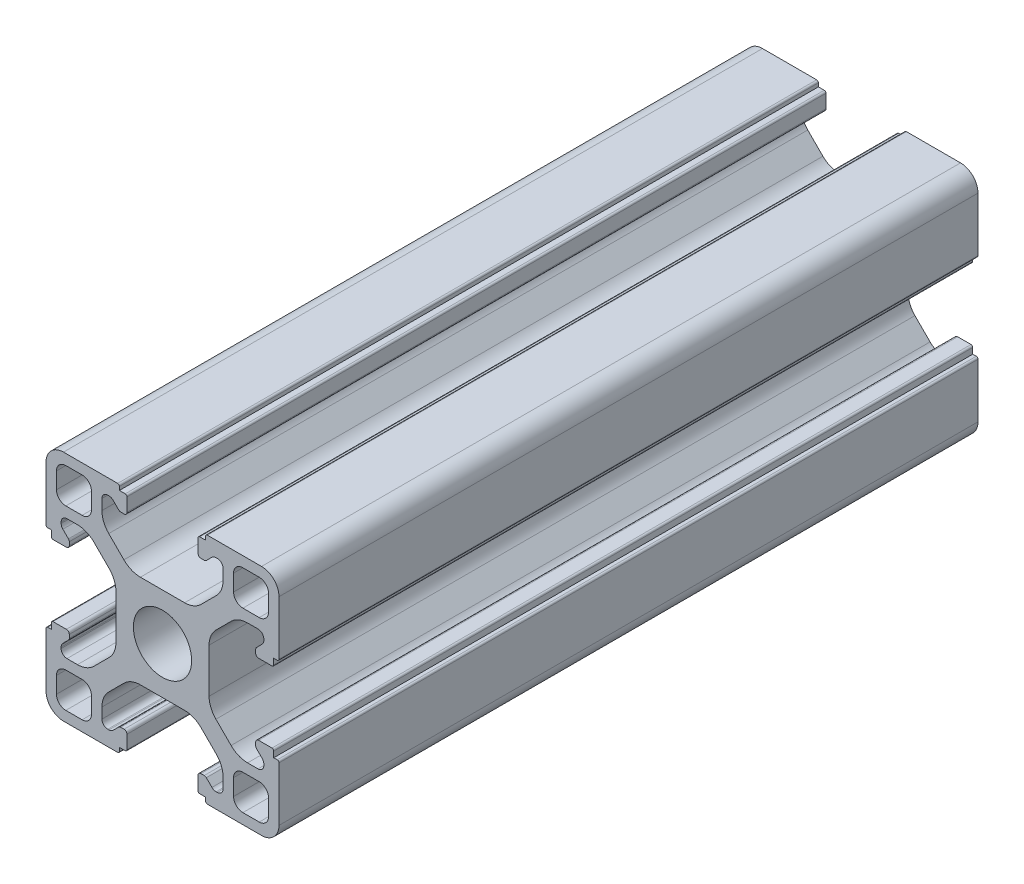
from build123d import *

# Parameters (mm, degrees)
EXTRUDE_1_DEPTH = 60


with BuildPart() as part:
    # Эскиз1 → Бобышка-Вытянуть1 (new body)
    with BuildSketch(Plane.XY):
        with BuildLine():
            Line((-0.000296307, 4.55357973), (1.898484362, 4.55357973))
            ThreePointArc((1.898484362, 4.55357973), (2.663851227, 4.705820665), (3.312697924, 5.139366167))
            Line((3.312697924, 5.139366167), (4.613917255, 6.440585498))
            ThreePointArc((4.613917255, 6.440585498), (5.047462758, 7.089432196), (5.199703693, 7.854799061))
            Line((5.199703693, 7.854799061), (5.199703693, 8.75357973))
            ThreePointArc((5.199703693, 8.75357973), (5.053257083, 9.10713312), (4.699703693, 9.25357973))
            Line((4.699703693, 9.25357973), (4.596810474, 9.25357973))
            ThreePointArc((4.596810474, 9.25357973), (4.405468758, 9.215519496), (4.243257083, 9.10713312))
            Line((4.243257083, 9.10713312), (3.762926997, 8.626803034))
            ThreePointArc((3.762926997, 8.626803034), (3.68182116, 8.572609847), (3.586150302, 8.55357973))
            Line((3.586150302, 8.55357973), (3.299703693, 8.55357973))
            ThreePointArc((3.299703693, 8.55357973), (3.122926997, 8.626803034), (3.049703693, 8.80357973))
            Line((3.049703693, 8.80357973), (3.049703693, 9.95265055))
            ThreePointArc((3.049703693, 9.95265055), (3.093637676, 10.058716567), (3.199703693, 10.10265055))
            Line((3.199703693, 10.10265055), (3.699703693, 10.10265055))
            Line((3.699703693, 10.10265055), (3.699703693, 10.40357973))
            ThreePointArc((3.699703693, 10.40357973), (3.743637676, 10.509645747), (3.849703693, 10.55357973))
            Line((3.849703693, 10.55357973), (8.499703693, 10.55357973))
            ThreePointArc((8.499703693, 10.55357973), (9.560363865, 10.114239901), (9.999703693, 9.05357973))
            Line((9.999703693, 9.05357973), (9.999703693, 4.40357973))
            ThreePointArc((9.999703693, 4.40357973), (9.95576971, 4.297513712), (9.849703693, 4.25357973))
            Line((9.849703693, 4.25357973), (9.548774513, 4.25357973))
            Line((9.548774513, 4.25357973), (9.548774513, 3.75357973))
            ThreePointArc((9.548774513, 3.75357973), (9.50484053, 3.647513712), (9.398774513, 3.60357973))
            Line((9.398774513, 3.60357973), (8.249703693, 3.60357973))
            ThreePointArc((8.249703693, 3.60357973), (8.072926997, 3.676803034), (7.999703693, 3.85357973))
            Line((7.999703693, 3.85357973), (7.999703693, 4.140026339))
            ThreePointArc((7.999703693, 4.140026339), (8.01873381, 4.235697197), (8.072926997, 4.316803034))
            Line((8.072926997, 4.316803034), (8.553257083, 4.79713312))
            ThreePointArc((8.553257083, 4.79713312), (8.661643459, 4.959344795), (8.699703693, 5.150686511))
            Line((8.699703693, 5.150686511), (8.699703693, 5.25357973))
            ThreePointArc((8.699703693, 5.25357973), (8.553257083, 5.60713312), (8.199703693, 5.75357973))
            Line((8.199703693, 5.75357973), (7.300923024, 5.75357973))
            ThreePointArc((7.300923024, 5.75357973), (6.535556159, 5.601338795), (5.886709461, 5.167793292))
            Line((5.886709461, 5.167793292), (4.58549013, 3.866573961))
            ThreePointArc((4.58549013, 3.866573961), (4.151944628, 3.217727263), (3.999703693, 2.452360399))
            Line((3.999703693, 2.452360399), (3.999703693, 0.55357973))
            Line((3.999703693, 0.55357973), (3.999703693, -1.345200939))
            ThreePointArc((3.999703693, -1.345200939), (4.151944628, -2.110567804), (4.58549013, -2.759414502))
            Line((4.58549013, -2.759414502), (5.886709461, -4.060633833))
            ThreePointArc((5.886709461, -4.060633833), (6.535556159, -4.494179335), (7.300923024, -4.64642027))
            Line((7.300923024, -4.64642027), (8.199703693, -4.64642027))
            ThreePointArc((8.199703693, -4.64642027), (8.553257083, -4.499973661), (8.699703693, -4.14642027))
            Line((8.699703693, -4.14642027), (8.699703693, -4.043527052))
            ThreePointArc((8.699703693, -4.043527052), (8.661643459, -3.852185335), (8.553257083, -3.689973661))
            Line((8.553257083, -3.689973661), (8.072926997, -3.209643575))
            ThreePointArc((8.072926997, -3.209643575), (8.01873381, -3.128537738), (7.999703693, -3.03286688))
            Line((7.999703693, -3.03286688), (7.999703693, -2.74642027))
            ThreePointArc((7.999703693, -2.74642027), (8.072926997, -2.569643575), (8.249703693, -2.49642027))
            Line((8.249703693, -2.49642027), (9.398774513, -2.49642027))
            ThreePointArc((9.398774513, -2.49642027), (9.50484053, -2.540354253), (9.548774513, -2.64642027))
            Line((9.548774513, -2.64642027), (9.548774513, -3.14642027))
            Line((9.548774513, -3.14642027), (9.849703693, -3.14642027))
            ThreePointArc((9.849703693, -3.14642027), (9.95576971, -3.190354253), (9.999703693, -3.29642027))
            Line((9.999703693, -3.29642027), (9.999703693, -7.94642027))
            ThreePointArc((9.999703693, -7.94642027), (9.560363865, -9.007080442), (8.499703693, -9.44642027))
            Line((8.499703693, -9.44642027), (3.849703693, -9.44642027))
            ThreePointArc((3.849703693, -9.44642027), (3.743637676, -9.402486288), (3.699703693, -9.29642027))
            Line((3.699703693, -9.29642027), (3.699703693, -8.995491091))
            Line((3.699703693, -8.995491091), (3.199703693, -8.995491091))
            ThreePointArc((3.199703693, -8.995491091), (3.093637676, -8.951557108), (3.049703693, -8.845491091))
            Line((3.049703693, -8.845491091), (3.049703693, -7.69642027))
            ThreePointArc((3.049703693, -7.69642027), (3.122926997, -7.519643575), (3.299703693, -7.44642027))
            Line((3.299703693, -7.44642027), (3.586150302, -7.44642027))
            ThreePointArc((3.586150302, -7.44642027), (3.68182116, -7.465450387), (3.762926997, -7.519643575))
            Line((3.762926997, -7.519643575), (4.243257083, -7.999973661))
            ThreePointArc((4.243257083, -7.999973661), (4.405468758, -8.108360037), (4.596810474, -8.14642027))
            Line((4.596810474, -8.14642027), (4.699703693, -8.14642027))
            ThreePointArc((4.699703693, -8.14642027), (5.053257083, -7.999973661), (5.199703693, -7.64642027))
            Line((5.199703693, -7.64642027), (5.199703693, -6.747639601))
            ThreePointArc((5.199703693, -6.747639601), (5.047462758, -5.982272737), (4.613917255, -5.333426039))
            Line((4.613917255, -5.333426039), (3.312697924, -4.032206708))
            ThreePointArc((3.312697924, -4.032206708), (2.663851227, -3.598661205), (1.898484362, -3.44642027))
            Line((1.898484362, -3.44642027), (-0.000296307, -3.44642027))
            Line((-0.000296307, -3.44642027), (-1.899076976, -3.44642027))
            ThreePointArc((-1.899076976, -3.44642027), (-2.664443841, -3.598661205), (-3.313290539, -4.032206708))
            Line((-3.313290539, -4.032206708), (-4.61450987, -5.333426039))
            ThreePointArc((-4.61450987, -5.333426039), (-5.048055372, -5.982272737), (-5.200296307, -6.747639601))
            Line((-5.200296307, -6.747639601), (-5.200296307, -7.64642027))
            ThreePointArc((-5.200296307, -7.64642027), (-5.053849698, -7.999973661), (-4.700296307, -8.14642027))
            Line((-4.700296307, -8.14642027), (-4.597403088, -8.14642027))
            ThreePointArc((-4.597403088, -8.14642027), (-4.406061372, -8.108360037), (-4.243849698, -7.999973661))
            Line((-4.243849698, -7.999973661), (-3.763519612, -7.519643575))
            ThreePointArc((-3.763519612, -7.519643575), (-3.682413775, -7.465450387), (-3.586742917, -7.44642027))
            Line((-3.586742917, -7.44642027), (-3.300296307, -7.44642027))
            ThreePointArc((-3.300296307, -7.44642027), (-3.123519612, -7.519643575), (-3.050296307, -7.69642027))
            Line((-3.050296307, -7.69642027), (-3.050296307, -8.845491091))
            ThreePointArc((-3.050296307, -8.845491091), (-3.09423029, -8.951557108), (-3.200296307, -8.995491091))
            Line((-3.200296307, -8.995491091), (-3.700296307, -8.995491091))
            Line((-3.700296307, -8.995491091), (-3.700296307, -9.29642027))
            ThreePointArc((-3.700296307, -9.29642027), (-3.74423029, -9.402486288), (-3.850296307, -9.44642027))
            Line((-3.850296307, -9.44642027), (-8.500296307, -9.44642027))
            ThreePointArc((-8.500296307, -9.44642027), (-9.560956479, -9.007080442), (-10.000296307, -7.94642027))
            Line((-10.000296307, -7.94642027), (-10.000296307, -3.29642027))
            ThreePointArc((-10.000296307, -3.29642027), (-9.956362324, -3.190354253), (-9.850296307, -3.14642027))
            Line((-9.850296307, -3.14642027), (-9.549367128, -3.14642027))
            Line((-9.549367128, -3.14642027), (-9.549367128, -2.64642027))
            ThreePointArc((-9.549367128, -2.64642027), (-9.505433145, -2.540354253), (-9.399367128, -2.49642027))
            Line((-9.399367128, -2.49642027), (-8.250296307, -2.49642027))
            ThreePointArc((-8.250296307, -2.49642027), (-8.073519612, -2.569643575), (-8.000296307, -2.74642027))
            Line((-8.000296307, -2.74642027), (-8.000296307, -3.03286688))
            ThreePointArc((-8.000296307, -3.03286688), (-8.019326424, -3.128537738), (-8.073519612, -3.209643575))
            Line((-8.073519612, -3.209643575), (-8.553849698, -3.689973661))
            ThreePointArc((-8.553849698, -3.689973661), (-8.662236073, -3.852185335), (-8.700296307, -4.043527052))
            Line((-8.700296307, -4.043527052), (-8.700296307, -4.14642027))
            ThreePointArc((-8.700296307, -4.14642027), (-8.553849698, -4.499973661), (-8.200296307, -4.64642027))
            Line((-8.200296307, -4.64642027), (-7.301515638, -4.64642027))
            ThreePointArc((-7.301515638, -4.64642027), (-6.536148773, -4.494179335), (-5.887302076, -4.060633833))
            Line((-5.887302076, -4.060633833), (-4.586082745, -2.759414502))
            ThreePointArc((-4.586082745, -2.759414502), (-4.152537242, -2.110567804), (-4.000296307, -1.345200939))
            Line((-4.000296307, -1.345200939), (-4.000296307, 0.55357973))
            Line((-4.000296307, 0.55357973), (-4.000296307, 2.452360399))
            ThreePointArc((-4.000296307, 2.452360399), (-4.152537242, 3.217727263), (-4.586082745, 3.866573961))
            Line((-4.586082745, 3.866573961), (-5.887302076, 5.167793292))
            ThreePointArc((-5.887302076, 5.167793292), (-6.536148773, 5.601338795), (-7.301515638, 5.75357973))
            Line((-7.301515638, 5.75357973), (-8.200296307, 5.75357973))
            ThreePointArc((-8.200296307, 5.75357973), (-8.553849698, 5.60713312), (-8.700296307, 5.25357973))
            Line((-8.700296307, 5.25357973), (-8.700296307, 5.150686511))
            ThreePointArc((-8.700296307, 5.150686511), (-8.662236073, 4.959344795), (-8.553849698, 4.79713312))
            Line((-8.553849698, 4.79713312), (-8.073519612, 4.316803034))
            ThreePointArc((-8.073519612, 4.316803034), (-8.019326424, 4.235697197), (-8.000296307, 4.140026339))
            Line((-8.000296307, 4.140026339), (-8.000296307, 3.85357973))
            ThreePointArc((-8.000296307, 3.85357973), (-8.073519612, 3.676803034), (-8.250296307, 3.60357973))
            Line((-8.250296307, 3.60357973), (-9.399367128, 3.60357973))
            ThreePointArc((-9.399367128, 3.60357973), (-9.505433145, 3.647513712), (-9.549367128, 3.75357973))
            Line((-9.549367128, 3.75357973), (-9.549367128, 4.25357973))
            Line((-9.549367128, 4.25357973), (-9.850296307, 4.25357973))
            ThreePointArc((-9.850296307, 4.25357973), (-9.956362324, 4.297513712), (-10.000296307, 4.40357973))
            Line((-10.000296307, 4.40357973), (-10.000296307, 9.05357973))
            ThreePointArc((-10.000296307, 9.05357973), (-9.560956479, 10.114239901), (-8.500296307, 10.55357973))
            Line((-8.500296307, 10.55357973), (-3.850296307, 10.55357973))
            ThreePointArc((-3.850296307, 10.55357973), (-3.74423029, 10.509645747), (-3.700296307, 10.40357973))
            Line((-3.700296307, 10.40357973), (-3.700296307, 10.10265055))
            Line((-3.700296307, 10.10265055), (-3.200296307, 10.10265055))
            ThreePointArc((-3.200296307, 10.10265055), (-3.09423029, 10.058716567), (-3.050296307, 9.95265055))
            Line((-3.050296307, 9.95265055), (-3.050296307, 8.80357973))
            ThreePointArc((-3.050296307, 8.80357973), (-3.123519612, 8.626803034), (-3.300296307, 8.55357973))
            Line((-3.300296307, 8.55357973), (-3.586742917, 8.55357973))
            ThreePointArc((-3.586742917, 8.55357973), (-3.682413775, 8.572609847), (-3.763519612, 8.626803034))
            Line((-3.763519612, 8.626803034), (-4.243849698, 9.10713312))
            ThreePointArc((-4.243849698, 9.10713312), (-4.406061372, 9.215519496), (-4.597403088, 9.25357973))
            Line((-4.597403088, 9.25357973), (-4.700296307, 9.25357973))
            ThreePointArc((-4.700296307, 9.25357973), (-5.053849698, 9.10713312), (-5.200296307, 8.75357973))
            Line((-5.200296307, 8.75357973), (-5.200296307, 7.854799061))
            ThreePointArc((-5.200296307, 7.854799061), (-5.048055372, 7.089432196), (-4.61450987, 6.440585498))
            Line((-4.61450987, 6.440585498), (-3.313290539, 5.139366167))
            ThreePointArc((-3.313290539, 5.139366167), (-2.664443841, 4.705820665), (-1.899076976, 4.55357973))
            Line((-1.899076976, 4.55357973), (-0.000296307, 4.55357973))
        make_face()
        with BuildLine():
            Line((6.899703693, 6.65357973), (8.299703693, 6.65357973))
            ThreePointArc((8.299703693, 6.65357973), (8.865389118, 6.887894305), (9.099703693, 7.45357973))
            Line((9.099703693, 7.45357973), (9.099703693, 8.85357973))
            ThreePointArc((9.099703693, 8.85357973), (8.865389118, 9.419265155), (8.299703693, 9.65357973))
            Line((8.299703693, 9.65357973), (6.899703693, 9.65357973))
            ThreePointArc((6.899703693, 9.65357973), (6.334018268, 9.419265155), (6.099703693, 8.85357973))
            Line((6.099703693, 8.85357973), (6.099703693, 7.45357973))
            ThreePointArc((6.099703693, 7.45357973), (6.334018268, 6.887894305), (6.899703693, 6.65357973))
        make_face(mode=Mode.SUBTRACT)
        with BuildLine():
            Line((6.099703693, -6.34642027), (6.099703693, -7.74642027))
            ThreePointArc((6.099703693, -7.74642027), (6.334018268, -8.312105695), (6.899703693, -8.54642027))
            Line((6.899703693, -8.54642027), (8.299703693, -8.54642027))
            ThreePointArc((8.299703693, -8.54642027), (8.865389118, -8.312105695), (9.099703693, -7.74642027))
            Line((9.099703693, -7.74642027), (9.099703693, -6.34642027))
            ThreePointArc((9.099703693, -6.34642027), (8.865389118, -5.780734845), (8.299703693, -5.54642027))
            Line((8.299703693, -5.54642027), (6.899703693, -5.54642027))
            ThreePointArc((6.899703693, -5.54642027), (6.334018268, -5.780734845), (6.099703693, -6.34642027))
        make_face(mode=Mode.SUBTRACT)
        with BuildLine():
            Line((-6.900296307, -5.54642027), (-8.300296307, -5.54642027))
            ThreePointArc((-8.300296307, -5.54642027), (-8.865981732, -5.780734845), (-9.100296307, -6.34642027))
            Line((-9.100296307, -6.34642027), (-9.100296307, -7.74642027))
            ThreePointArc((-9.100296307, -7.74642027), (-8.865981732, -8.312105695), (-8.300296307, -8.54642027))
            Line((-8.300296307, -8.54642027), (-6.900296307, -8.54642027))
            ThreePointArc((-6.900296307, -8.54642027), (-6.334610882, -8.312105695), (-6.100296307, -7.74642027))
            Line((-6.100296307, -7.74642027), (-6.100296307, -6.34642027))
            ThreePointArc((-6.100296307, -6.34642027), (-6.334610882, -5.780734845), (-6.900296307, -5.54642027))
        make_face(mode=Mode.SUBTRACT)
        with BuildLine():
            Line((-6.100296307, 7.45357973), (-6.100296307, 8.85357973))
            ThreePointArc((-6.100296307, 8.85357973), (-6.334610882, 9.419265155), (-6.900296307, 9.65357973))
            Line((-6.900296307, 9.65357973), (-8.300296307, 9.65357973))
            ThreePointArc((-8.300296307, 9.65357973), (-8.865981732, 9.419265155), (-9.100296307, 8.85357973))
            Line((-9.100296307, 8.85357973), (-9.100296307, 7.45357973))
            ThreePointArc((-9.100296307, 7.45357973), (-8.865981732, 6.887894305), (-8.300296307, 6.65357973))
            Line((-8.300296307, 6.65357973), (-6.900296307, 6.65357973))
            ThreePointArc((-6.900296307, 6.65357973), (-6.334610882, 6.887894305), (-6.100296307, 7.45357973))
        make_face(mode=Mode.SUBTRACT)
        with BuildLine():
            ThreePointArc((2.499703693, 0.55357973), (1.767470646, 2.321346683), (-0.000296307, 3.05357973))
            ThreePointArc((-0.000296307, 3.05357973), (-1.76806326, 2.321346683), (-2.500296307, 0.55357973))
            ThreePointArc((-2.500296307, 0.55357973), (-1.76806326, -1.214187223), (-0.000296307, -1.94642027))
            ThreePointArc((-0.000296307, -1.94642027), (1.767470646, -1.214187223), (2.499703693, 0.55357973))
        make_face(mode=Mode.SUBTRACT)
    extrude(amount=EXTRUDE_1_DEPTH)


solid = part.part
